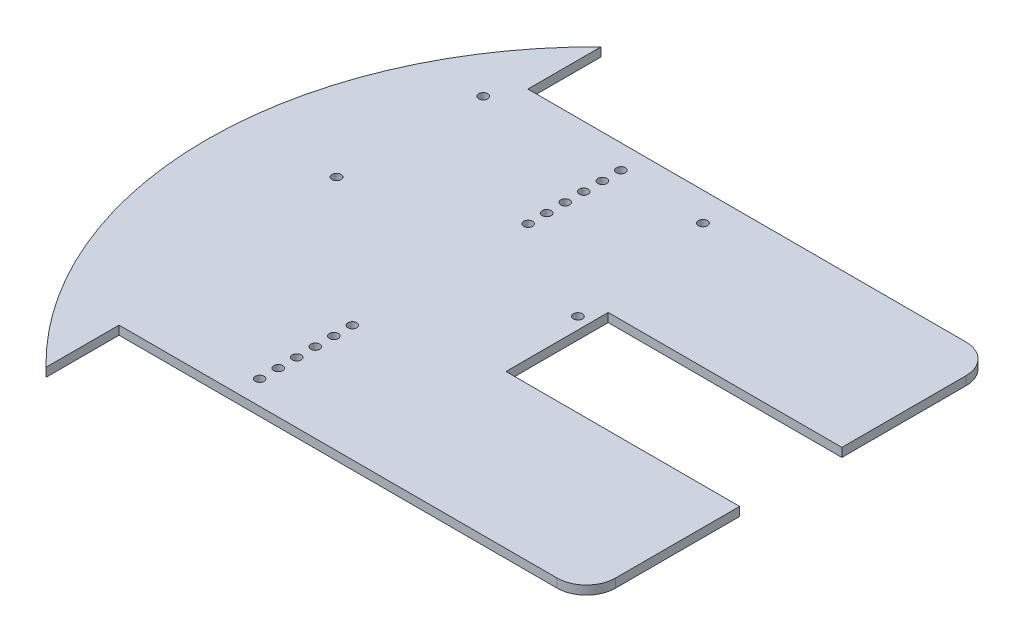
from build123d import *

# Parameters (mm, degrees)
SKETCH1_R           = 1.525
BOSS_EXTRUDE1_DEPTH = 3
SKETCH2_W           = 80
SKETCH2_H           = 35
CUT_EXTRUDE1_DEPTH  = 5
SKETCH4_R           = 1.55
CUT_EXTRUDE2_DEPTH  = 277.097497981


with BuildPart() as part:
    # Sketch1 → Boss-Extrude1 (new body)
    with BuildSketch(Plane(origin=(0, 3, 0), x_dir=(1, 0, 0), z_dir=(0, 1, 0))):
        with BuildLine():
            Line((200.301843205, 35), (200.301843205, 155))
            ThreePointArc((200.301843205, 155), (197.372911017, 162.071067812), (190.301843205, 165))
            Line((190.301843205, 165), (40.301843205, 165))
            Line((40.301843205, 165), (40.301843205, 190))
            ThreePointArc((40.301843205, 190), (0.301843205, 95), (40.301843205, 0))
            Line((40.301843205, 0), (40.301843205, 25))
            Line((40.301843205, 25), (190.301843205, 25))
            ThreePointArc((190.301843205, 25), (197.372911017, 27.928932188), (200.301843205, 35))
        make_face()
        with Locations(Location((80.301843205, 33.16, 0), (0, 0, 90))):
            Circle(SKETCH1_R, mode=Mode.SUBTRACT)
        with Locations(Location((80.301843205, 125.09, 0), (0, 0, 90))):
            Circle(SKETCH1_R, mode=Mode.SUBTRACT)
        with Locations(Location((80.301843205, 131.44, 0), (0, 0, 90))):
            Circle(SKETCH1_R, mode=Mode.SUBTRACT)
        with Locations(Location((80.301843205, 137.79, 0), (0, 0, 90))):
            Circle(SKETCH1_R, mode=Mode.SUBTRACT)
        with Locations(Location((80.301843205, 64.91, 0), (0, 0, 90))):
            Circle(SKETCH1_R, mode=Mode.SUBTRACT)
        with Locations(Location((80.301843205, 156.84, 0), (0, 0, 90))):
            Circle(SKETCH1_R, mode=Mode.SUBTRACT)
        with Locations(Location((80.301843205, 150.49, 0), (0, 0, 90))):
            Circle(SKETCH1_R, mode=Mode.SUBTRACT)
        with Locations(Location((80.301843205, 144.14, 0), (0, 0, 90))):
            Circle(SKETCH1_R, mode=Mode.SUBTRACT)
        with Locations(Location((80.301843205, 58.56, 0), (0, 0, 90))):
            Circle(SKETCH1_R, mode=Mode.SUBTRACT)
        with Locations(Location((80.301843205, 52.21, 0), (0, 0, 90))):
            Circle(SKETCH1_R, mode=Mode.SUBTRACT)
        with Locations(Location((80.301843205, 45.86, 0), (0, 0, 90))):
            Circle(SKETCH1_R, mode=Mode.SUBTRACT)
        with Locations(Location((80.301843205, 39.51, 0), (0, 0, 90))):
            Circle(SKETCH1_R, mode=Mode.SUBTRACT)
    extrude(amount=-BOSS_EXTRUDE1_DEPTH)

    # Sketch2 → Cut-Extrude1 (cut)
    with BuildSketch(Plane(origin=(0, 3, 0), x_dir=(1, 0, 0), z_dir=(0, 1, 0))):
        with Locations((160.301843205, 95)):
            Rectangle(SKETCH2_W, SKETCH2_H)
    extrude(amount=-CUT_EXTRUDE1_DEPTH, mode=Mode.SUBTRACT)

    # Sketch4 → Cut-Extrude2 (cut, through all)
    with BuildSketch(Plane(origin=(0, 3, 0), x_dir=(1, 0, 0), z_dir=(0, 1, 0))):
        with Locations(Location((34.819271837, 155.2, 0), (0, 0, 270))):
            Circle(SKETCH4_R)
        with Locations(Location((33.619271837, 106.15, 0), (0, 0, 270))):
            Circle(SKETCH4_R)
        with Locations(Location((110.019271837, 155.2, 0), (0, 0, 270))):
            Circle(SKETCH4_R)
        with Locations(Location((116.269271837, 106.15, 0), (0, 0, 270))):
            Circle(SKETCH4_R)
    extrude(amount=-CUT_EXTRUDE2_DEPTH, mode=Mode.SUBTRACT)


solid = part.part
